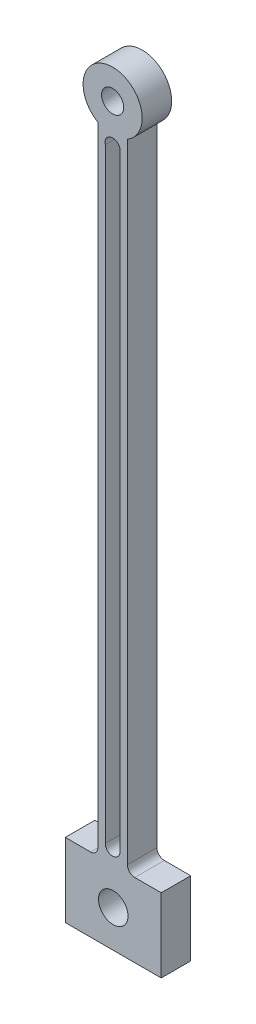
from build123d import *

# Parameters (mm, degrees)
SKETCH1_R           = 5
SKETCH1_R_2         = 6
SKETCH1_R_3         = 3
SKETCH1_R_4         = 4
BOSS_EXTRUDE1_DEPTH = 8


with BuildPart() as part:
    # Sketch1 → Boss-Extrude1 (new body)
    # profile 1 of 3: a face of its own
    with BuildSketch(Plane.XY):
        with BuildLine():
            Line((13.16300623, -179.16324922), (6, -179.16324922))
            ThreePointArc((6, -179.16324922), (4.585786438, -178.577462783), (4, -177.16324922))
            Line((4, -177.16324922), (4, -6.92820323))
            ThreePointArc((4, -6.92820323), (0, 8), (-4, -6.92820323))
            Line((-4, -6.92820323), (-4, -177.16324922))
            ThreePointArc((-4, -177.16324922), (-4.585786438, -178.577462783), (-6, -179.16324922))
            Line((-6, -179.16324922), (-12.83699377, -179.16324922))
            Line((-12.83699377, -179.16324922), (-12.83699377, -199.16324922))
            Line((-12.83699377, -199.16324922), (13.16300623, -199.16324922))
            Line((13.16300623, -199.16324922), (13.16300623, -179.16324922))
        make_face()
        Circle(SKETCH1_R, mode=Mode.SUBTRACT)
        with Locations((0.16300623, -189.16324922)):
            Circle(SKETCH1_R_2, mode=Mode.SUBTRACT)
        with BuildLine():
            ThreePointArc((-2, -175.16324922), (0, -177.16324922), (2, -175.16324922))
            Line((2, -175.16324922), (2, -11.176871049))
            ThreePointArc((2, -11.176871049), (0, -8.621835967), (-2, -11.176871049))
            Line((-2, -11.176871049), (-2, -175.16324922))
        make_face(mode=Mode.SUBTRACT)
    # profile 2 of 3: a face of its own
    with BuildSketch(Plane.XY):
        Circle(SKETCH1_R)
        Circle(SKETCH1_R_3, mode=Mode.SUBTRACT)
    # profile 3 of 3: a face of its own
    with BuildSketch(Plane.XY):
        with Locations((0.16300623, -189.16324922)):
            Circle(SKETCH1_R_2)
        with Locations((0.16300623, -189.16324922)):
            Circle(SKETCH1_R_4, mode=Mode.SUBTRACT)
    extrude(amount=BOSS_EXTRUDE1_DEPTH)


solid = part.part
